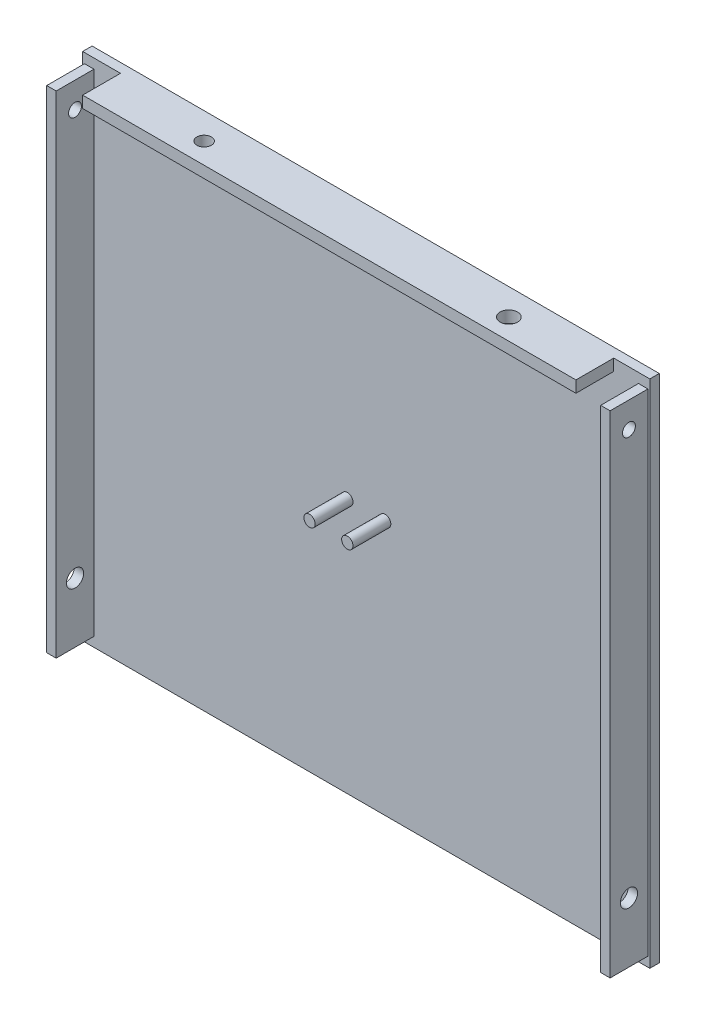
from build123d import *

# Parameters (mm, degrees)
CROQUIS1_W              = 300
CROQUIS1_H              = 270
SALIENTE_EXTRUIR1_DEPTH = 5
CROQUIS2_W              = 5
CROQUIS2_H              = 259.826620651
CROQUIS2_W_2            = 260.893012834
CROQUIS2_H_2            = 6.115910783
SALIENTE_EXTRUIR2_DEPTH = 20
CROQUIS3_R              = 3.417677686
CROQUIS3_R_2            = 4.551592261
CORTAR_EXTRUIR1_DEPTH   = 330.015197217
CROQUIS4_R              = 3
SALIENTE_EXTRUIR3_DEPTH = 20
CROQUIS5_R              = 3.841776338
CROQUIS5_R_2            = 4.628228364
CORTAR_EXTRUIR2_DEPTH   = 20


with BuildPart() as part:
    # Croquis1 → Saliente-Extruir1 (new body)
    with BuildSketch(Plane.XY):
        Rectangle(CROQUIS1_W, CROQUIS1_H)
    extrude(amount=SALIENTE_EXTRUIR1_DEPTH)

    # Croquis2 → Saliente-Extruir2 (add)
    with BuildSketch(Plane.XY.offset(5)):
        with Locations((-146.5, -0.015689121)):
            Rectangle(CROQUIS2_W, CROQUIS2_H)
        with Locations((146.5, -0.015689121)):
            Rectangle(CROQUIS2_W, CROQUIS2_H)
        with Locations((0.463771802, 131.942044608)):
            Rectangle(CROQUIS2_W_2, CROQUIS2_H_2)
    extrude(amount=SALIENTE_EXTRUIR2_DEPTH)

    # Croquis3 → Cortar-Extruir1 (cut, through all)
    with BuildSketch(Plane.ZY.offset(149)):
        with Locations(Location((15.036244293, 116.297685092, 0), (0, 0, 90))):
            Circle(CROQUIS3_R)
        with Locations(Location((15.036244293, -98.258041649, 0), (0, 0, 90))):
            Circle(CROQUIS3_R_2)
    extrude(amount=-CORTAR_EXTRUIR1_DEPTH, mode=Mode.SUBTRACT)

    # Croquis4 → Saliente-Extruir3 (add)
    with BuildSketch(Plane.XY.offset(5)):
        with Locations((-10, 0)):
            Circle(CROQUIS4_R)
        with Locations((10, 0)):
            Circle(CROQUIS4_R)
    extrude(amount=SALIENTE_EXTRUIR3_DEPTH)

    # Croquis5 → Cortar-Extruir2 (cut)
    with BuildSketch(Plane(origin=(0, 135, 0), x_dir=(1, 0, 0), z_dir=(0, 1, 0))):
        with Locations(Location((-76.809917119, -13.943258858, 0), (0, 0, 180))):
            Circle(CROQUIS5_R)
        with Locations(Location((84.376229975, -13.943258858, 0), (0, 0, 180))):
            Circle(CROQUIS5_R_2)
    extrude(amount=-CORTAR_EXTRUIR2_DEPTH, mode=Mode.SUBTRACT)


solid = part.part
